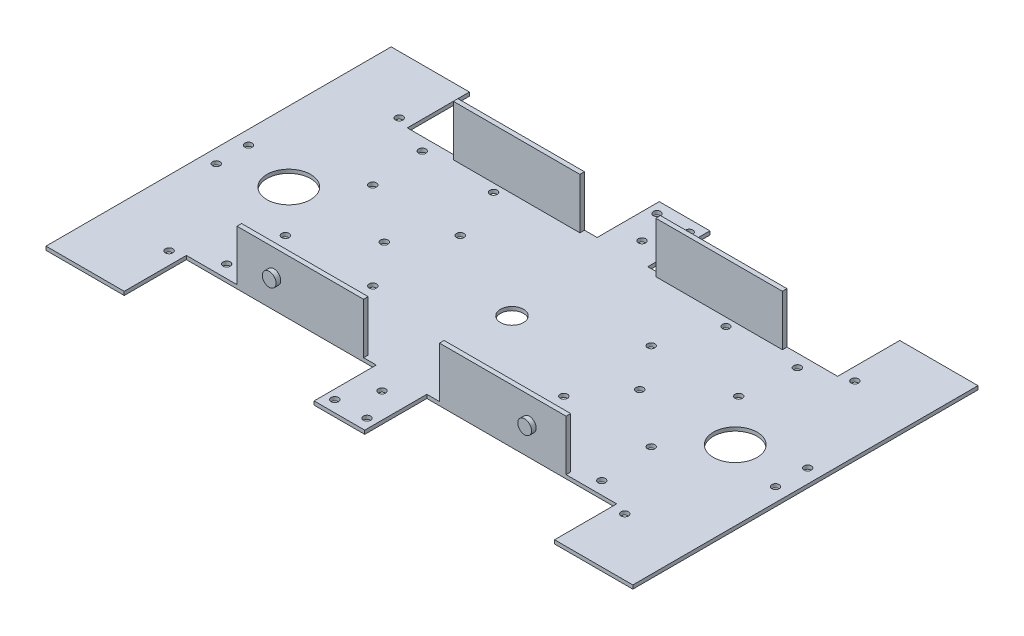
from build123d import *

# Parameters (mm, degrees)
SKETCH_2_R             = 5
EXTRUDE_1_DEPTH        = 0.8
SKETCH_3_W             = 55
SKETCH_3_H             = 2
EXTRUDE_2_DEPTH        = 22
SKETCH_4_R             = 3
EXTRUDE_3_DEPTH        = 2
PATTERN_LINEAR_1_COUNT = 2
PATTERN_LINEAR_1_PITCH = 98
SKETCH_5_R             = 1.6
SKETCH_5_R_2           = 9.5
CUT_EXTRUDE_1_DEPTH    = 2


with BuildPart() as part:
    # 草图2 → 凸台-拉伸1 (new, symmetric)
    with BuildSketch(Plane(origin=(0, 0, 0), x_dir=(1, 0, 0), z_dir=(0, 1, 0))):
        Polygon((-127.5, 75), (-127.5, -75), (-93.5, -75), (-93.5, -48), (-11, -48), (-11, -75), (11, -75), (11, -48), (93.5, -48), (93.5, -75), (127.5, -75), (127.5, 75), (93.5, 75), (93.5, 48), (11, 48), (11, 75), (-11, 75), (-11, 48), (-93.5, 48), (-93.5, 75), align=None)
        with Locations(Location((0, 0, 0), (0, 0, 270))):
            Circle(SKETCH_2_R, mode=Mode.SUBTRACT)
    extrude(amount=EXTRUDE_1_DEPTH, both=True)

    # 草图3 → 凸台-拉伸2 (add)
    with BuildSketch(Plane(origin=(0, 0.8, 0), x_dir=(1, 0, 0), z_dir=(0, 1, 0))):
        with Locations((-44, -47)):
            Rectangle(SKETCH_3_W, SKETCH_3_H)
        with Locations((44, -47)):
            Rectangle(SKETCH_3_W, SKETCH_3_H)
        with Locations((44, 47)):
            Rectangle(SKETCH_3_W, SKETCH_3_H)
        with Locations((-44, 47)):
            Rectangle(SKETCH_3_W, SKETCH_3_H)
    extrude(amount=EXTRUDE_2_DEPTH)

    # 草图4 → 凸台-拉伸3 (add)
    with BuildSketch(Plane.XY.offset(48)):
        with Locations((55.5, 11.8)):
            Circle(SKETCH_4_R)
        with Locations(Location((-55.5, 11.8, 0), (0, 0, 180))):
            Circle(SKETCH_4_R)
    extrude_3 = extrude(amount=EXTRUDE_3_DEPTH)

    # 阵列(线性)1: 凸台-拉伸3 ×2
    with Locations(*[(0, 0, -i * PATTERN_LINEAR_1_PITCH) for i in range(1, PATTERN_LINEAR_1_COUNT)]):
        add(extrude_3)

    # 草图5 → 切除-拉伸1 (cut)
    with BuildSketch(Plane.XZ.offset(0.8)):
        with Locations(Location((-55.5, 0, 0), (0, 0, 270))):
            Circle(SKETCH_5_R)
        with Locations(Location((0, 56.5, 0), (0, 0, 270))):
            Circle(SKETCH_5_R)
        with Locations(Location((7, 70, 0), (0, 0, 270))):
            Circle(SKETCH_5_R)
        with Locations(Location((-7, 70, 0), (0, 0, 270))):
            Circle(SKETCH_5_R)
        with Locations(Location((99, 50, 0), (0, 0, 270))):
            Circle(SKETCH_5_R)
        with Locations(Location((-81.5, -42.5, 0), (0, 0, 270))):
            Circle(SKETCH_5_R)
        with Locations(Location((-50.5, -42.5, 0), (0, 0, 270))):
            Circle(SKETCH_5_R)
        with Locations(Location((-99, -50, 0), (0, 0, 270))):
            Circle(SKETCH_5_R)
        with Locations(Location((-97, 0, 0), (0, 0, 270))):
            Circle(SKETCH_5_R_2)
        with Locations(Location((-121.5, -7, 0), (0, 0, 270))):
            Circle(SKETCH_5_R)
        with Locations(Location((55.5, 0, 0), (0, 0, 90))):
            Circle(SKETCH_5_R)
        with Locations(Location((81.5, -42.5, 0), (0, 0, 90))):
            Circle(SKETCH_5_R)
        with Locations(Location((50.5, -42.5, 0), (0, 0, 90))):
            Circle(SKETCH_5_R)
        with Locations(Location((99, -50, 0), (0, 0, 90))):
            Circle(SKETCH_5_R)
        with Locations(Location((121.5, -7, 0), (0, 0, 90))):
            Circle(SKETCH_5_R)
        with Locations(Location((97, 0, 0), (0, 0, 270))):
            Circle(SKETCH_5_R_2)
        with Locations(Location((7, -70, 0), (0, 0, 90))):
            Circle(SKETCH_5_R)
        with Locations(Location((-7, -70, 0), (0, 0, 90))):
            Circle(SKETCH_5_R)
        with Locations(Location((0, -56.5, 0), (0, 0, 90))):
            Circle(SKETCH_5_R)
        with Locations(Location((50.5, 42.5, 0), (0, 0, 270))):
            Circle(SKETCH_5_R)
        with Locations(Location((81.5, 42.5, 0), (0, 0, 270))):
            Circle(SKETCH_5_R)
        with Locations(Location((121.5, 7, 0), (0, 0, 270))):
            Circle(SKETCH_5_R)
        with Locations(Location((-50.5, 42.5, 0), (0, 0, 90))):
            Circle(SKETCH_5_R)
        with Locations(Location((-121.5, 7, 0), (0, 0, 90))):
            Circle(SKETCH_5_R)
        with Locations(Location((-81.5, 42.5, 0), (0, 0, 90))):
            Circle(SKETCH_5_R)
        with Locations(Location((-99, 50, 0), (0, 0, 90))):
            Circle(SKETCH_5_R)
        with Locations(Location((-79.5, 19, 0), (0, 0, 270))):
            Circle(SKETCH_5_R)
        with Locations(Location((-41.5, 19, 0), (0, 0, 270))):
            Circle(SKETCH_5_R)
        with Locations(Location((-41.5, -19, 0), (0, 0, 90))):
            Circle(SKETCH_5_R)
        with Locations(Location((-79.5, -19, 0), (0, 0, 270))):
            Circle(SKETCH_5_R)
        with Locations(Location((41.5, 19, 0), (0, 0, 90))):
            Circle(SKETCH_5_R)
        with Locations(Location((79.5, 19, 0), (0, 0, 90))):
            Circle(SKETCH_5_R)
        with Locations(Location((41.5, -19, 0), (0, 0, 270))):
            Circle(SKETCH_5_R)
        with Locations(Location((79.5, -19, 0), (0, 0, 270))):
            Circle(SKETCH_5_R)
    extrude(amount=-CUT_EXTRUDE_1_DEPTH, mode=Mode.SUBTRACT)


solid = part.part
